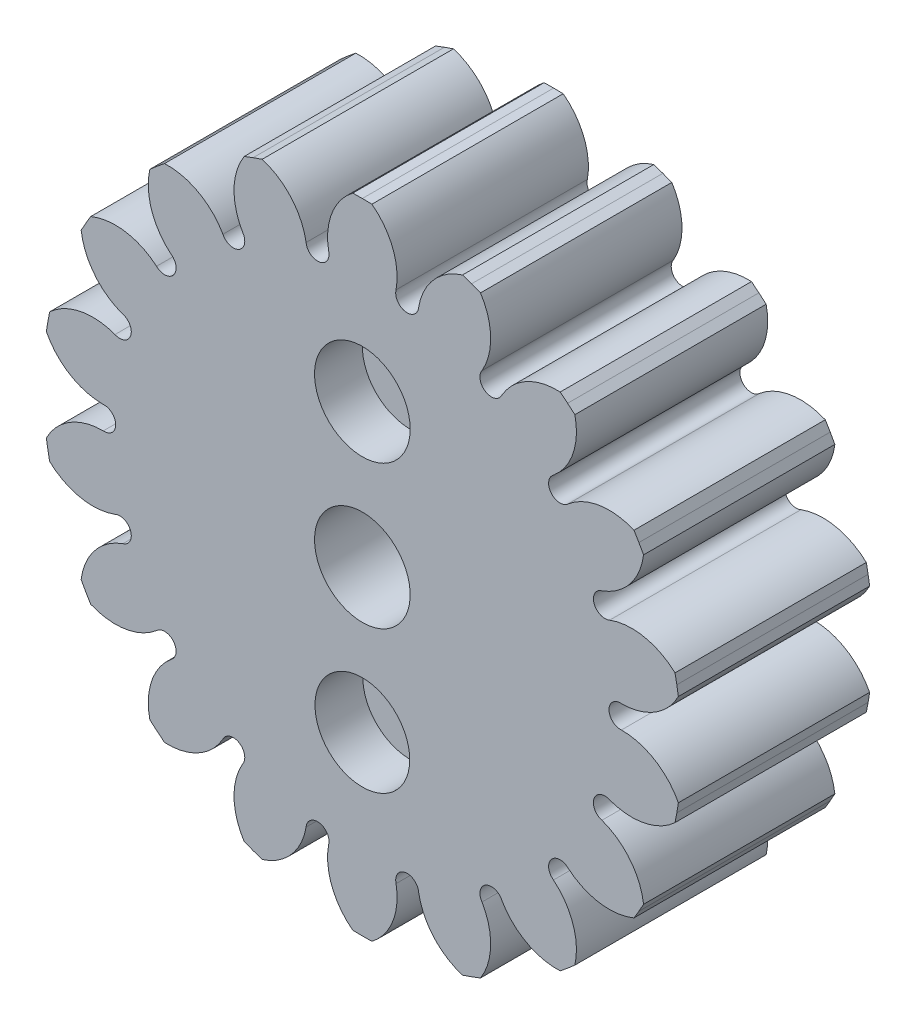
from build123d import *

# Parameters (mm, degrees)
BOSS_EXTRUDE1_DEPTH = 25.4
SKETCH2_R           = 6.35
SKETCH2_R_2         = 6.289382054
CUT_EXTRUDE1_DEPTH  = 6.35
SKETCH3_R           = 6.35
CUT_EXTRUDE2_DEPTH  = 65.834626806


with BuildPart() as part:
    # Sketch1 → Boss-Extrude1 (new body)
    with BuildSketch(Plane.XY):
        with BuildLine():
            Line((1.27, 42.381959669), (0, 42.400983542))
            Line((0, 42.400983542), (-1.27, 42.381959669))
            ThreePointArc((-1.27, 42.381959669), (-4.039167101, 38.714670348), (-4.477654975, 34.140282326))
            ThreePointArc((-4.477654975, 34.140282326), (-5.686801313, 32.251452896), (-7.469044916, 33.61281957))
            ThreePointArc((-7.469044916, 33.61281957), (-9.445621582, 37.761366553), (-13.302074292, 40.260380337))
            Line((-13.302074292, 40.260380337), (-14.501990468, 39.843891349))
            Line((-14.501990468, 39.843891349), (-15.688893549, 39.391649173))
            ThreePointArc((-15.688893549, 39.391649173), (-17.036772621, 34.998413532), (-15.884283593, 30.549923177))
            ThreePointArc((-15.884283593, 30.549923177), (-16.374491771, 28.361451696), (-18.514867758, 29.031154701))
            ThreePointArc((-18.514867758, 29.031154701), (-21.7911289, 32.253484654), (-26.269722106, 33.282804957))
            Line((-26.269722106, 33.282804957), (-27.25482686, 32.481037825))
            Line((-27.25482686, 32.481037825), (-28.215474992, 31.650124428))
            ThreePointArc((-28.215474992, 31.650124428), (-27.979491926, 27.060831521), (-25.375033182, 23.274792424))
            ThreePointArc((-25.375033182, 23.274792424), (-25.08717686, 21.050640851), (-27.327524299, 20.947904121))
            ThreePointArc((-27.327524299, 20.947904121), (-31.50830447, 22.855356494), (-36.068853735, 22.290832097))
            Line((-36.068853735, 22.290832097), (-36.720328893, 21.200491771))
            Line((-36.720328893, 21.200491771), (-37.338853735, 20.091127572))
            ThreePointArc((-37.338853735, 20.091127572), (-35.547471572, 15.859313854), (-31.805179274, 13.192378205))
            ThreePointArc((-31.805179274, 13.192378205), (-30.773978173, 11.200812045), (-32.844078098, 10.338027146))
            ThreePointArc((-32.844078098, 10.338027146), (-37.425113508, 10.700535032), (-41.517549284, 8.610255909))
            Line((-41.517549284, 8.610255909), (-41.756817328, 7.362853523))
            Line((-41.756817328, 7.362853523), (-41.958615655, 6.108844216))
            ThreePointArc((-41.958615655, 6.108844216), (-38.827901521, 2.744928878), (-34.399151351, 1.518768476))
            ThreePointArc((-34.399151351, 1.518768476), (-32.748983542, 0), (-34.399151351, -1.518768476))
            ThreePointArc((-34.399151351, -1.518768476), (-38.827901521, -2.744928878), (-41.958615655, -6.108844216))
            Line((-41.958615655, -6.108844216), (-41.756817328, -7.362853523))
            Line((-41.756817328, -7.362853523), (-41.517549284, -8.610255909))
            ThreePointArc((-41.517549284, -8.610255909), (-37.425113508, -10.700535032), (-32.844078098, -10.338027146))
            ThreePointArc((-32.844078098, -10.338027146), (-30.773978173, -11.200812045), (-31.805179274, -13.192378205))
            ThreePointArc((-31.805179274, -13.192378205), (-35.547471572, -15.859313854), (-37.338853735, -20.091127572))
            Line((-37.338853735, -20.091127572), (-36.720328893, -21.200491771))
            Line((-36.720328893, -21.200491771), (-36.068853735, -22.290832097))
            ThreePointArc((-36.068853735, -22.290832097), (-31.50830447, -22.855356494), (-27.327524299, -20.947904121))
            ThreePointArc((-27.327524299, -20.947904121), (-25.08717686, -21.050640851), (-25.375033182, -23.274792424))
            ThreePointArc((-25.375033182, -23.274792424), (-27.979491926, -27.060831521), (-28.215474992, -31.650124428))
            Line((-28.215474992, -31.650124428), (-27.25482686, -32.481037825))
            Line((-27.25482686, -32.481037825), (-26.269722106, -33.282804957))
            ThreePointArc((-26.269722106, -33.282804957), (-21.7911289, -32.253484654), (-18.514867758, -29.031154701))
            ThreePointArc((-18.514867758, -29.031154701), (-16.374491771, -28.361451696), (-15.884283593, -30.549923177))
            ThreePointArc((-15.884283593, -30.549923177), (-17.036772621, -34.998413532), (-15.688893549, -39.391649173))
            Line((-15.688893549, -39.391649173), (-14.501990468, -39.843891349))
            Line((-14.501990468, -39.843891349), (-13.302074292, -40.260380337))
            ThreePointArc((-13.302074292, -40.260380337), (-9.445621582, -37.761366553), (-7.469044916, -33.61281957))
            ThreePointArc((-7.469044916, -33.61281957), (-5.686801313, -32.251452896), (-4.477654975, -34.140282326))
            ThreePointArc((-4.477654975, -34.140282326), (-4.039167101, -38.714670348), (-1.27, -42.381959669))
            Line((-1.27, -42.381959669), (0, -42.400983542))
            Line((0, -42.400983542), (1.27, -42.381959669))
            ThreePointArc((1.27, -42.381959669), (4.039167101, -38.714670348), (4.477654975, -34.140282326))
            ThreePointArc((4.477654975, -34.140282326), (5.686801313, -32.251452896), (7.469044916, -33.61281957))
            ThreePointArc((7.469044916, -33.61281957), (9.445621582, -37.761366553), (13.302074292, -40.260380337))
            Line((13.302074292, -40.260380337), (14.501990468, -39.843891349))
            Line((14.501990468, -39.843891349), (15.688893549, -39.391649173))
            ThreePointArc((15.688893549, -39.391649173), (17.036772621, -34.998413532), (15.884283593, -30.549923177))
            ThreePointArc((15.884283593, -30.549923177), (16.374491771, -28.361451696), (18.514867758, -29.031154701))
            ThreePointArc((18.514867758, -29.031154701), (21.7911289, -32.253484654), (26.269722106, -33.282804957))
            Line((26.269722106, -33.282804957), (27.25482686, -32.481037825))
            Line((27.25482686, -32.481037825), (28.215474992, -31.650124428))
            ThreePointArc((28.215474992, -31.650124428), (27.979491926, -27.060831521), (25.375033182, -23.274792424))
            ThreePointArc((25.375033182, -23.274792424), (25.08717686, -21.050640851), (27.327524299, -20.947904121))
            ThreePointArc((27.327524299, -20.947904121), (31.50830447, -22.855356494), (36.068853735, -22.290832097))
            Line((36.068853735, -22.290832097), (36.720328893, -21.200491771))
            Line((36.720328893, -21.200491771), (37.338853735, -20.091127572))
            ThreePointArc((37.338853735, -20.091127572), (35.547471572, -15.859313854), (31.805179274, -13.192378205))
            ThreePointArc((31.805179274, -13.192378205), (30.773978173, -11.200812045), (32.844078098, -10.338027146))
            ThreePointArc((32.844078098, -10.338027146), (37.425113508, -10.700535032), (41.517549284, -8.610255909))
            Line((41.517549284, -8.610255909), (41.756817328, -7.362853523))
            Line((41.756817328, -7.362853523), (41.958615655, -6.108844216))
            ThreePointArc((41.958615655, -6.108844216), (38.827901521, -2.744928878), (34.399151351, -1.518768476))
            ThreePointArc((34.399151351, -1.518768476), (32.748983542, 0), (34.399151351, 1.518768476))
            ThreePointArc((34.399151351, 1.518768476), (38.827901521, 2.744928878), (41.958615655, 6.108844216))
            Line((41.958615655, 6.108844216), (41.756817328, 7.362853523))
            Line((41.756817328, 7.362853523), (41.517549284, 8.610255909))
            ThreePointArc((41.517549284, 8.610255909), (37.425113508, 10.700535032), (32.844078098, 10.338027146))
            ThreePointArc((32.844078098, 10.338027146), (30.773978173, 11.200812045), (31.805179274, 13.192378205))
            ThreePointArc((31.805179274, 13.192378205), (35.547471572, 15.859313854), (37.338853735, 20.091127572))
            Line((37.338853735, 20.091127572), (36.720328893, 21.200491771))
            Line((36.720328893, 21.200491771), (36.068853735, 22.290832097))
            ThreePointArc((36.068853735, 22.290832097), (31.50830447, 22.855356494), (27.327524299, 20.947904121))
            ThreePointArc((27.327524299, 20.947904121), (25.08717686, 21.050640851), (25.375033182, 23.274792424))
            ThreePointArc((25.375033182, 23.274792424), (27.979491926, 27.060831521), (28.215474992, 31.650124428))
            Line((28.215474992, 31.650124428), (27.25482686, 32.481037825))
            Line((27.25482686, 32.481037825), (26.269722106, 33.282804957))
            ThreePointArc((26.269722106, 33.282804957), (21.7911289, 32.253484654), (18.514867758, 29.031154701))
            ThreePointArc((18.514867758, 29.031154701), (16.374491771, 28.361451696), (15.884283593, 30.549923177))
            ThreePointArc((15.884283593, 30.549923177), (17.036772621, 34.998413532), (15.688893549, 39.391649173))
            Line((15.688893549, 39.391649173), (14.501990468, 39.843891349))
            Line((14.501990468, 39.843891349), (13.302074292, 40.260380337))
            ThreePointArc((13.302074292, 40.260380337), (9.445621582, 37.761366553), (7.469044916, 33.61281957))
            ThreePointArc((7.469044916, 33.61281957), (5.686801313, 32.251452896), (4.477654975, 34.140282326))
            ThreePointArc((4.477654975, 34.140282326), (4.039167101, 38.714670348), (1.27, 42.381959669))
        make_face()
    extrude(amount=BOSS_EXTRUDE1_DEPTH)

    # Sketch2 → Cut-Extrude1 (cut)
    with BuildSketch(Plane.XY.offset(25.4)):
        with Locations((0, 19.05)):
            Circle(SKETCH2_R)
        with Locations((0, -18.989382054)):
            Circle(SKETCH2_R_2)
    cut_extrude1 = extrude(amount=-CUT_EXTRUDE1_DEPTH, mode=Mode.SUBTRACT)

    # Mirror2: Cut-Extrude1 across plane
    add(cut_extrude1.mirror(Plane.XY.offset(12.7)), mode=Mode.SUBTRACT)

    # Sketch3 → Cut-Extrude2 (cut, through all)
    with BuildSketch(Plane(origin=(0, 0, 0), x_dir=(-1, 0, 0), z_dir=(0, 0, -1))):
        Circle(SKETCH3_R)
    extrude(amount=-CUT_EXTRUDE2_DEPTH, mode=Mode.SUBTRACT)


solid = part.part
